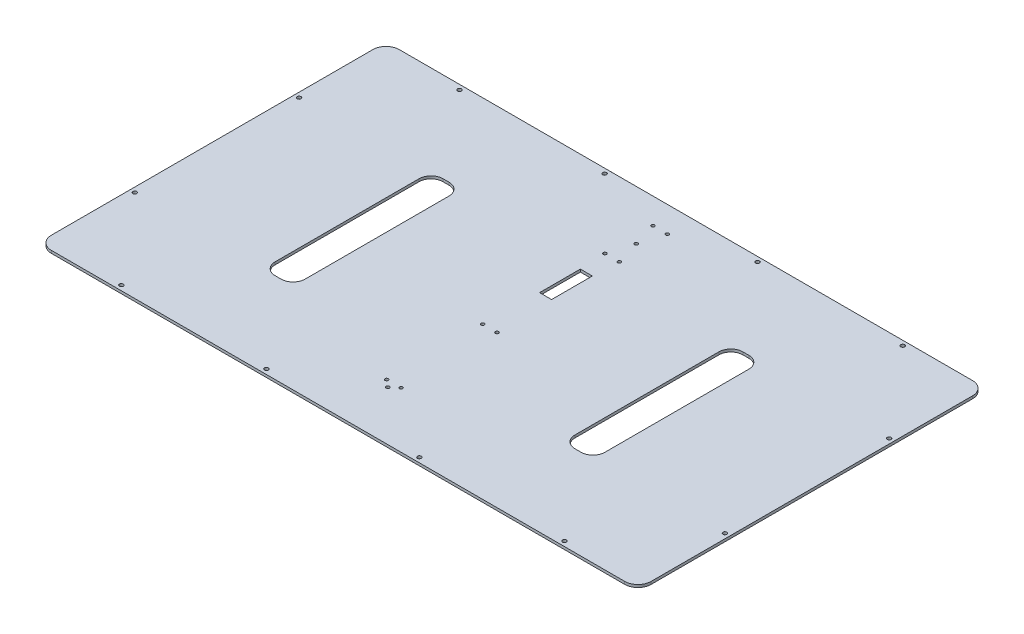
from build123d import *

# Parameters (mm, degrees)
SKETCH1_R           = 1.6
SKETCH1_R_2         = 1.4
SKETCH1_W           = 10
SKETCH1_H           = 34
BOSS_EXTRUDE1_DEPTH = 2.2
SKETCH2_R           = 1.35
CUT_EXTRUDE1_DEPTH  = 59.2


with BuildPart() as part:
    # Sketch1 → Boss-Extrude1 (new body)
    with BuildSketch(Plane(origin=(0, 0, 0), x_dir=(1, 0, 0), z_dir=(0, 1, 0))):
        with BuildLine():
            Line((-239, 145), (239, 145))
            ThreePointArc((239, 145), (246.778174593, 141.778174593), (250, 134))
            Line((250, 134), (250, -134))
            ThreePointArc((250, -134), (246.778174593, -141.778174593), (239, -145))
            Line((239, -145), (-239, -145))
            ThreePointArc((-239, -145), (-246.778174593, -141.778174593), (-250, -134))
            Line((-250, -134), (-250, 134))
            ThreePointArc((-250, 134), (-246.778174593, 141.778174593), (-239, 145))
        make_face()
        with Locations(Location((63.75, 141, 0), (0, 0, 270))):
            Circle(SKETCH1_R, mode=Mode.SUBTRACT)
        with Locations(Location((184.75, 141, 0), (0, 0, 270))):
            Circle(SKETCH1_R, mode=Mode.SUBTRACT)
        with Locations(Location((246, 68.5, 0), (0, 0, 270))):
            Circle(SKETCH1_R, mode=Mode.SUBTRACT)
        with Locations(Location((0, 103.5, 0), (0, 0, 270))):
            Circle(SKETCH1_R_2, mode=Mode.SUBTRACT)
        with Locations(Location((0, -103.5, 0), (0, 0, 270))):
            Circle(SKETCH1_R_2, mode=Mode.SUBTRACT)
        with Locations(Location((-246, 68.5, 0), (0, 0, 90))):
            Circle(SKETCH1_R, mode=Mode.SUBTRACT)
        with Locations(Location((-184.75, 141, 0), (0, 0, 90))):
            Circle(SKETCH1_R, mode=Mode.SUBTRACT)
        with Locations(Location((-63.75, 141, 0), (0, 0, 90))):
            Circle(SKETCH1_R, mode=Mode.SUBTRACT)
        with Locations(Location((184.75, -141, 0), (0, 0, 90))):
            Circle(SKETCH1_R, mode=Mode.SUBTRACT)
        with Locations(Location((246, -68.5, 0), (0, 0, 90))):
            Circle(SKETCH1_R, mode=Mode.SUBTRACT)
        with Locations(Location((63.75, -141, 0), (0, 0, 90))):
            Circle(SKETCH1_R, mode=Mode.SUBTRACT)
        with Locations(Location((-63.75, -141, 0), (0, 0, 270))):
            Circle(SKETCH1_R, mode=Mode.SUBTRACT)
        with Locations(Location((-184.75, -141, 0), (0, 0, 270))):
            Circle(SKETCH1_R, mode=Mode.SUBTRACT)
        with Locations(Location((-246, -68.5, 0), (0, 0, 270))):
            Circle(SKETCH1_R, mode=Mode.SUBTRACT)
        with BuildLine():
            Line((-127.5, -70), (-122.5, -70))
            ThreePointArc((-122.5, -70), (-115.428932188, -67.071067812), (-112.5, -60))
            Line((-112.5, -60), (-112.5, 60))
            ThreePointArc((-112.5, 60), (-115.428932188, 67.071067812), (-122.5, 70))
            Line((-122.5, 70), (-127.5, 70))
            ThreePointArc((-127.5, 70), (-134.571067812, 67.071067812), (-137.5, 60))
            Line((-137.5, 60), (-137.5, -60))
            ThreePointArc((-137.5, -60), (-134.571067812, -67.071067812), (-127.5, -70))
        make_face(mode=Mode.SUBTRACT)
        with BuildLine():
            Line((122.5, -70), (127.5, -70))
            ThreePointArc((127.5, -70), (134.571067812, -67.071067812), (137.5, -60))
            Line((137.5, -60), (137.5, 60))
            ThreePointArc((137.5, 60), (134.571067812, 67.071067812), (127.5, 70))
            Line((127.5, 70), (122.5, 70))
            ThreePointArc((122.5, 70), (115.428932188, 67.071067812), (112.5, 60))
            Line((112.5, 60), (112.5, -60))
            ThreePointArc((112.5, -60), (115.428932188, -67.071067812), (122.5, -70))
        make_face(mode=Mode.SUBTRACT)
        with Locations((0, 45)):
            Rectangle(SKETCH1_W, SKETCH1_H, mode=Mode.SUBTRACT)
    extrude(amount=BOSS_EXTRUDE1_DEPTH)

    # Sketch2 → Cut-Extrude1 (cut)
    with BuildSketch(Plane(origin=(0, 2.2, 0), x_dir=(1, 0, 0), z_dir=(0, 1, 0))):
        with Locations(Location((-6, -18.5, 0), (0, 0, 270))):
            Circle(SKETCH2_R)
        with Locations(Location((6, -18.5, 0), (0, 0, 270))):
            Circle(SKETCH2_R)
        with Locations(Location((-6, -98.5, 0), (0, 0, 270))):
            Circle(SKETCH2_R)
        with Locations(Location((6, -98.5, 0), (0, 0, 270))):
            Circle(SKETCH2_R)
        with Locations(Location((-6, 123.5, 0), (0, 0, 270))):
            Circle(SKETCH2_R)
        with Locations(Location((6, 123.5, 0), (0, 0, 270))):
            Circle(SKETCH2_R)
        with Locations(Location((-6, 83.5, 0), (0, 0, 270))):
            Circle(SKETCH2_R)
        with Locations(Location((6, 83.5, 0), (0, 0, 270))):
            Circle(SKETCH2_R)
    extrude(amount=-CUT_EXTRUDE1_DEPTH, mode=Mode.SUBTRACT)


solid = part.part
